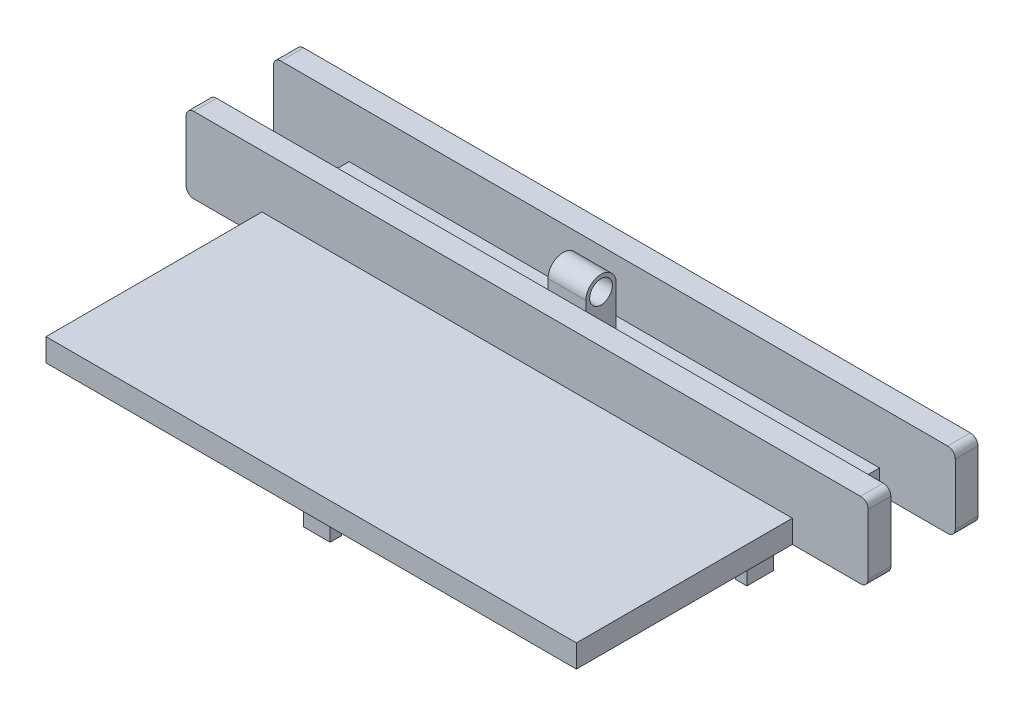
from build123d import *

# Parameters (mm, degrees)
SKETCH1_W              = 70
SKETCH1_H              = 50
BOSS_EXTRUDE1_DEPTH    = 3
SKETCH2_W              = 3.5
SKETCH2_H              = 1.5
SKETCH2_W_2            = 1.5
SKETCH2_H_2            = 3.5
BOSS_EXTRUDE2_DEPTH    = 2.5
BOSS_EXTRUDE3_DEPTH    = 3
FILLET1_R              = 1
LPATTERN1_COUNT        = 2
LPATTERN1_PITCH        = 11.5
FILLET1_OF_LPATTERN1_R = 1
SKETCH6_R              = 1.5
BOSS_EXTRUDE4_DEPTH    = 2.5


with BuildPart() as part:
    # Sketch1 → Boss-Extrude1 (new body)
    with BuildSketch(Plane(origin=(0, 0, 0), x_dir=(1, 0, 0), z_dir=(0, 1, 0))):
        Rectangle(SKETCH1_W, SKETCH1_H)
    extrude(amount=BOSS_EXTRUDE1_DEPTH)

    # Sketch2 → Boss-Extrude2 (add)
    with BuildSketch(Plane.XZ):
        with Locations((0, 23.5)):
            Rectangle(SKETCH2_W, SKETCH2_H)
        with Locations((33.5, 0)):
            Rectangle(SKETCH2_W_2, SKETCH2_H_2)
        with Locations((-33.5, 0)):
            Rectangle(SKETCH2_W_2, SKETCH2_H_2)
    extrude(amount=BOSS_EXTRUDE2_DEPTH)

    # Sketch5 → Boss-Extrude3 (add)
    with BuildSketch(Plane.XY.offset(-15)):
        Polygon((35, 3), (35, 0), (45, 0), (45, 10), (-45, 10), (-45, 0), (-35, 0), (-35, 3), align=None)
    boss_extrude3 = extrude(amount=-BOSS_EXTRUDE3_DEPTH)

    # Fillet1
    fillet1_edges = [part.edges().sort_by_distance(p)[0] for p in [
        (-45, 0, -16.5),
        (-45, 10, -16.5),
        (45, 10, -16.5),
        (45, 0, -16.5),
    ]]
    fillet(fillet1_edges, radius=FILLET1_R)

    # LPattern1: Boss-Extrude3 ×2
    with Locations(*[(0, 0, i * LPATTERN1_PITCH) for i in range(1, LPATTERN1_COUNT)]):
        add(boss_extrude3)

    # Fillet1 of LPattern1
    fillet1_of_lpattern1_edges = [part.edges().sort_by_distance(p)[0] for p in [
        (-45, 0, -5),
        (-45, 10, -5),
        (45, 10, -5),
        (45, 0, -5),
    ]]
    fillet(fillet1_of_lpattern1_edges, radius=FILLET1_OF_LPATTERN1_R)

    # Sketch6 → Boss-Extrude4 (add, symmetric)
    with BuildSketch(Plane.ZY):
        with BuildLine():
            Line((-12.75, 0), (-8.75, 0))
            Line((-8.75, 0), (-8.75, 9))
            ThreePointArc((-8.75, 9), (-10.75, 11), (-12.75, 9))
            Line((-12.75, 9), (-12.75, 0))
        make_face()
        with Locations((-10.75, 9)):
            Circle(SKETCH6_R, mode=Mode.SUBTRACT)
    extrude(amount=BOSS_EXTRUDE4_DEPTH, both=True)


solid = part.part
